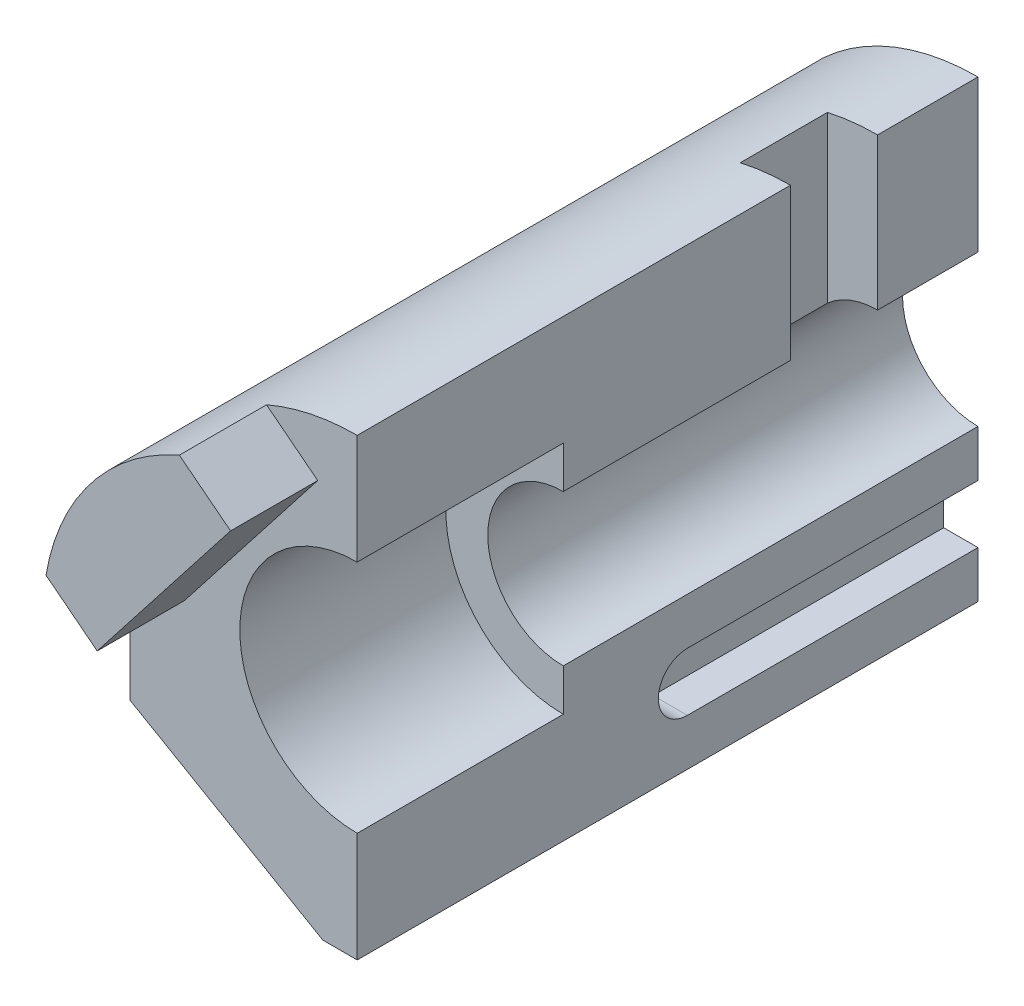
from build123d import *

# Parameters (mm, degrees)
BOSS_EXTRU_2_DEPTH           = 235
ESQUISSE2_R                  = 44.45
ENL_V_MAT_EXTRU_1_DEPTH      = 78
ESQUISSE3_R                  = 28.575
ENL_V_MAT_EXTRU_2_DEPTH      = 190
ENL_V_MAT_EXTRU_3_DEPTH      = 13
BOSS_EXTRU_3_DEPTH           = 111
ESQUISSE10_W                 = 33
ESQUISSE10_H                 = 39.549429839
ENL_V_MAT_EXTRU_5_DEPTH      = 19
ENL_V_MAT_EXTRU_6_REACH      = 313.068
ENL_V_MAT_EXTRU_6_END_RADIUS = 28.575
ESQUISSE11_W                 = 19
ESQUISSE11_H                 = 33


with BuildPart() as part:
    # Esquisse1 → Boss.-Extru.2 (new body)
    with BuildSketch(Plane.XY):
        with BuildLine():
            Line((0, 0), (-13, 0))
            Line((-13, 0), (-86, 42.146569651))
            Line((-86, 42.146569651), (-86, 85.999071056))
            ThreePointArc((-86, 85.999071056), (-60.811511616, 146.810854752), (0, 172))
            Line((0, 172), (0, 0))
        make_face()
    extrude(amount=BOSS_EXTRU_2_DEPTH)

    # Esquisse2 → Enlèv. mat.-Extru.1 (cut)
    with BuildSketch(Plane.XY.offset(235)):
        with Locations((0, 86)):
            Circle(ESQUISSE2_R)
    extrude(amount=-ENL_V_MAT_EXTRU_1_DEPTH, mode=Mode.SUBTRACT)

    # Esquisse3 → Enlèv. mat.-Extru.2 (cut)
    with BuildSketch(Plane.XY.offset(157)):
        with Locations((0, 86)):
            Circle(ESQUISSE3_R)
    extrude(amount=-ENL_V_MAT_EXTRU_2_DEPTH, mode=Mode.SUBTRACT)

    # Esquisse4 → Enlèv. mat.-Extru.3 (cut)
    with BuildSketch(Plane(origin=(0, 0, 0), x_dir=(0, 0, -1), z_dir=(1, 0, 0))):
        with BuildLine():
            Line((0, 17.7125), (-110, 17.7125))
            ThreePointArc((-110, 17.7125), (-121, 28.7125), (-110, 39.7125))
            Line((-110, 39.7125), (0, 39.7125))
            ThreePointArc((0, 39.7125), (11, 28.7125), (0, 17.7125))
        make_face()
    extrude(amount=-ENL_V_MAT_EXTRU_3_DEPTH, mode=Mode.SUBTRACT)

    # Esquisse7 → Boss.-Extru.3 (add)
    with BuildSketch(Plane.XY.offset(157)):
        with BuildLine():
            Line((-34.329616244, 164.850982549), (-14.946427951, 149.707176139))
            Line((-14.946427951, 149.707176139), (-40.188548439, 117.398735242))
            Line((-40.188548439, 117.398735242), (-65.430668927, 85.090294344))
            Line((-65.430668927, 85.090294344), (-84.81385722, 100.234100753))
            ThreePointArc((-84.81385722, 100.234100753), (-67.768924815, 138.946886878), (-34.329616244, 164.850982549))
        make_face()
    extrude(amount=BOSS_EXTRU_3_DEPTH)

    # Esquisse10 → Enlèv. mat.-Extru.5 (cut)
    with BuildSketch(Plane(origin=(0, 0, 0), x_dir=(0, 0, -1), z_dir=(1, 0, 0))):
        with Locations((-54.5, 152.22528508)):
            Rectangle(ESQUISSE10_W, ESQUISSE10_H)
    extrude(amount=-ENL_V_MAT_EXTRU_5_DEPTH, mode=Mode.SUBTRACT)

    # Enlèv. mat.-Extru.6: up to this cylinder (the profile starts outside it)
    enl_v_mat_extru_6_end = Plane(origin=(0, 86, 54.5), z_dir=(0, 0, 1)) * Cylinder(ENL_V_MAT_EXTRU_6_END_RADIUS, 684.286, mode=Mode.PRIVATE)
    # Esquisse11 → Enlèv. mat.-Extru.6 (cut, up to the surface)
    with BuildSketch(Plane(origin=(0, 132.450570161, 0), x_dir=(1, 0, 0), z_dir=(0, 1, 0)), mode=Mode.PRIVATE) as enl_v_mat_extru_6_sk1:
        with Locations((-9.5, -54.5)):
            Rectangle(ESQUISSE11_W, ESQUISSE11_H)
    enl_v_mat_extru_6_tool1 = extrude(enl_v_mat_extru_6_sk1.sketch, amount=-ENL_V_MAT_EXTRU_6_REACH, mode=Mode.PRIVATE) - enl_v_mat_extru_6_end
    add(enl_v_mat_extru_6_tool1.solids().sort_by_distance((-9.5, 132.45057, 54.5))[0], mode=Mode.SUBTRACT)


solid = part.part
